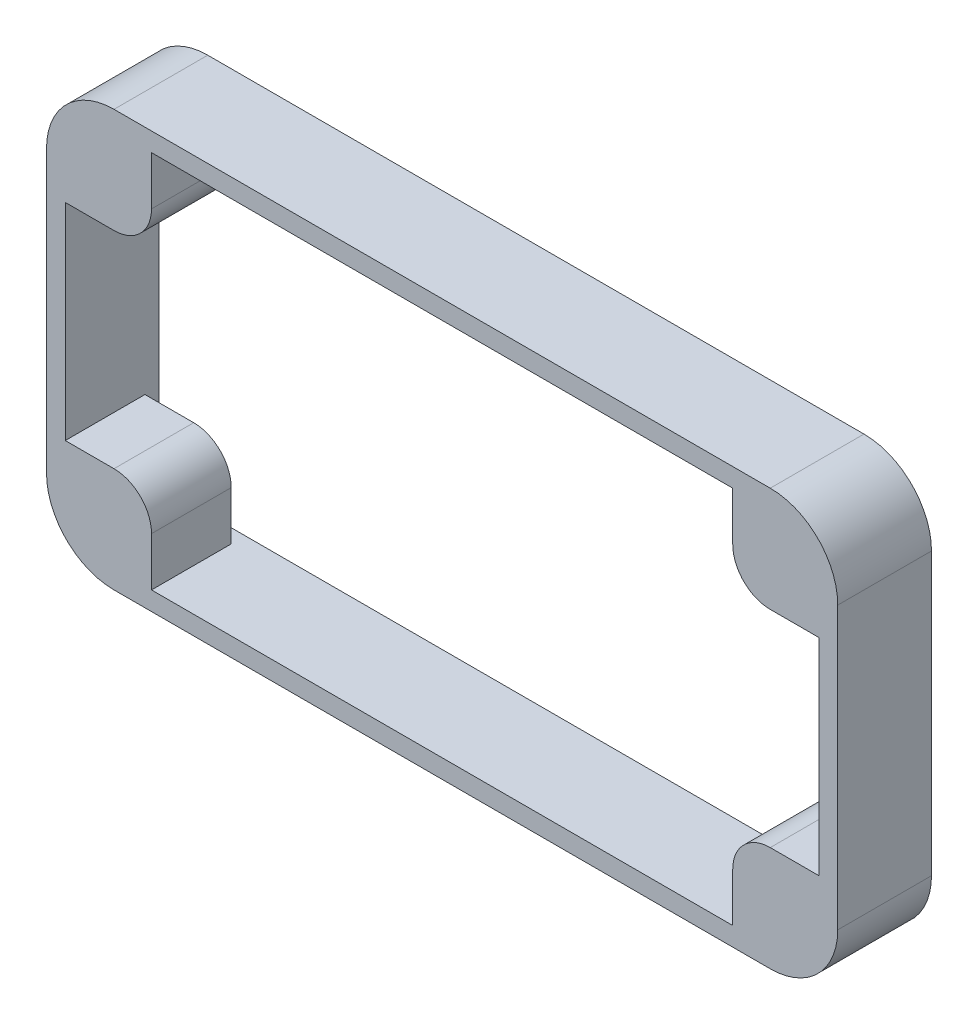
from build123d import *

# Parameters (mm, degrees)
EXTRUDE_1_DEPTH = 10
EXTRUDE_START   = -1.5
EXTRUDE_2_DEPTH = 8.5


with BuildPart() as part:
    # Эскиз1 → Бобышка-Вытянуть1 (new body)
    with BuildSketch(Plane.XY):
        with BuildLine():
            Line((-35, 22.2), (35, 22.2))
            ThreePointArc((35, 22.2), (40.091168825, 20.091168825), (42.2, 15))
            Line((42.2, 15), (42.2, -15))
            ThreePointArc((42.2, -15), (40.091168825, -20.091168825), (35, -22.2))
            Line((35, -22.2), (-35, -22.2))
            ThreePointArc((-35, -22.2), (-40.091168825, -20.091168825), (-42.2, -15))
            Line((-42.2, -15), (-42.2, 15))
            ThreePointArc((-42.2, 15), (-40.091168825, 20.091168825), (-35, 22.2))
        make_face()
        with BuildLine():
            Line((-40.2, -15), (-40.2, 15))
            ThreePointArc((-40.2, 15), (-38.676955262, 18.676955262), (-35, 20.2))
            Line((-35, 20.2), (35, 20.2))
            ThreePointArc((35, 20.2), (38.676955262, 18.676955262), (40.2, 15))
            Line((40.2, 15), (40.2, -15))
            ThreePointArc((40.2, -15), (38.676955262, -18.676955262), (35, -20.2))
            Line((35, -20.2), (-35, -20.2))
            ThreePointArc((-35, -20.2), (-38.676955262, -18.676955262), (-40.2, -15))
        make_face(mode=Mode.SUBTRACT)
    extrude(amount=EXTRUDE_1_DEPTH)

    # Эскиз2 → Бобышка-Вытянуть2 (add)
    with BuildSketch(Plane(origin=(0, 0, 0), x_dir=(-1, 0, 0), z_dir=(0, 0, -1)).offset(EXTRUDE_START)):
        with BuildLine():
            Line((31, 15), (31, 20.2))
            Line((31, 20.2), (35, 20.2))
            ThreePointArc((35, 20.2), (38.676955262, 18.676955262), (40.2, 15))
            Line((40.2, 15), (40.2, 11))
            Line((40.2, 11), (35, 11))
            ThreePointArc((35, 11), (32.171572875, 12.171572875), (31, 15))
        make_face()
        with BuildLine():
            Line((-35, 20.2), (-31, 20.2))
            Line((-31, 20.2), (-31, 15))
            ThreePointArc((-31, 15), (-32.171572875, 12.171572875), (-35, 11))
            Line((-35, 11), (-40.2, 11))
            Line((-40.2, 11), (-40.2, 15))
            ThreePointArc((-40.2, 15), (-38.676955262, 18.676955262), (-35, 20.2))
        make_face()
        with BuildLine():
            Line((-31, -15), (-31, -20.2))
            Line((-31, -20.2), (-35, -20.2))
            ThreePointArc((-35, -20.2), (-38.676955262, -18.676955262), (-40.2, -15))
            Line((-40.2, -15), (-40.2, -11))
            Line((-40.2, -11), (-35, -11))
            ThreePointArc((-35, -11), (-32.171572875, -12.171572875), (-31, -15))
        make_face()
        with BuildLine():
            Line((35, -20.2), (31, -20.2))
            Line((31, -20.2), (31, -15))
            ThreePointArc((31, -15), (32.171572875, -12.171572875), (35, -11))
            Line((35, -11), (40.2, -11))
            Line((40.2, -11), (40.2, -15))
            ThreePointArc((40.2, -15), (38.676955262, -18.676955262), (35, -20.2))
        make_face()
    extrude(amount=-EXTRUDE_2_DEPTH)


solid = part.part
